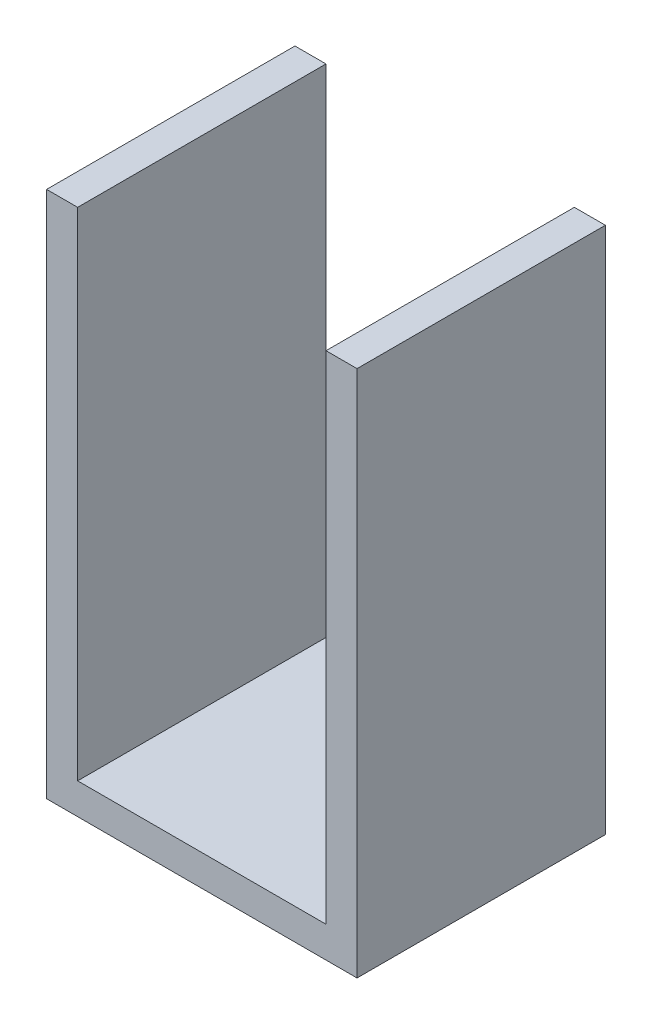
from build123d import *

# Parameters (mm, degrees)
SKETCH2_W           = 40
SKETCH2_H           = 40
BOSS_EXTRUDE1_DEPTH = 5
SKETCH3_W           = 40
SKETCH3_H           = 5
BOSS_EXTRUDE2_DEPTH = 10
SKETCH4_W           = 5
SKETCH4_H           = 40
BOSS_EXTRUDE3_DEPTH = 80


with BuildPart() as part:
    # Sketch2 → Boss-Extrude1 (new body)
    with BuildSketch(Plane(origin=(0, 0, 0), x_dir=(1, 0, 0), z_dir=(0, 1, 0))):
        Rectangle(SKETCH2_W, SKETCH2_H)
    extrude(amount=BOSS_EXTRUDE1_DEPTH)

    # Sketch3 → Boss-Extrude2 (add)
    with BuildSketch(Plane(origin=(20, 0, 0), x_dir=(0, 0, -1), z_dir=(1, 0, 0))):
        with Locations((0, 2.5)):
            Rectangle(SKETCH3_W, SKETCH3_H)
    extrude(amount=BOSS_EXTRUDE2_DEPTH)

    # Sketch4 → Boss-Extrude3 (add)
    with BuildSketch(Plane(origin=(0, 5, 0), x_dir=(1, 0, 0), z_dir=(0, 1, 0))):
        with Locations((-17.5, 0)):
            Rectangle(SKETCH4_W, SKETCH4_H)
        with Locations((27.5, 0)):
            Rectangle(SKETCH4_W, SKETCH4_H)
    extrude(amount=BOSS_EXTRUDE3_DEPTH)


solid = part.part
